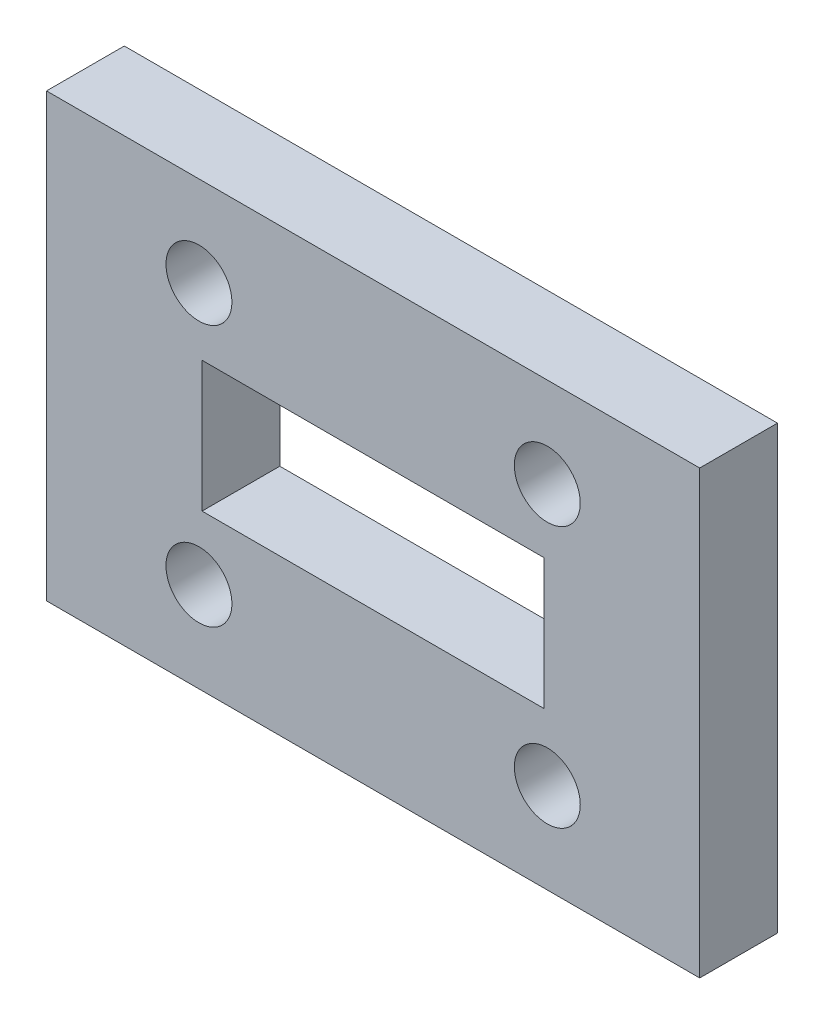
from build123d import *

# Parameters (mm, degrees)
SKETCH2_W           = 26.67
SKETCH2_H           = 18.034
SKETCH2_R           = 1.3462
SKETCH2_W_2         = 13.97
SKETCH2_H_2         = 5.334
BOSS_EXTRUDE1_DEPTH = 3.175


with BuildPart() as part:
    # Sketch2 → Boss-Extrude1 (new body)
    with BuildSketch(Plane.XY):
        Rectangle(SKETCH2_W, SKETCH2_H)
        with Locations((-7.112, 5.334)):
            Circle(SKETCH2_R, mode=Mode.SUBTRACT)
        with Locations(Location((7.112, 5.334, 0), (0, 0, 180))):
            Circle(SKETCH2_R, mode=Mode.SUBTRACT)
        with Locations((7.112, -5.334)):
            Circle(SKETCH2_R, mode=Mode.SUBTRACT)
        with Locations(Location((-7.112, -5.334, 0), (0, 0, 180))):
            Circle(SKETCH2_R, mode=Mode.SUBTRACT)
        Rectangle(SKETCH2_W_2, SKETCH2_H_2, mode=Mode.SUBTRACT)
    extrude(amount=BOSS_EXTRUDE1_DEPTH)


solid = part.part
